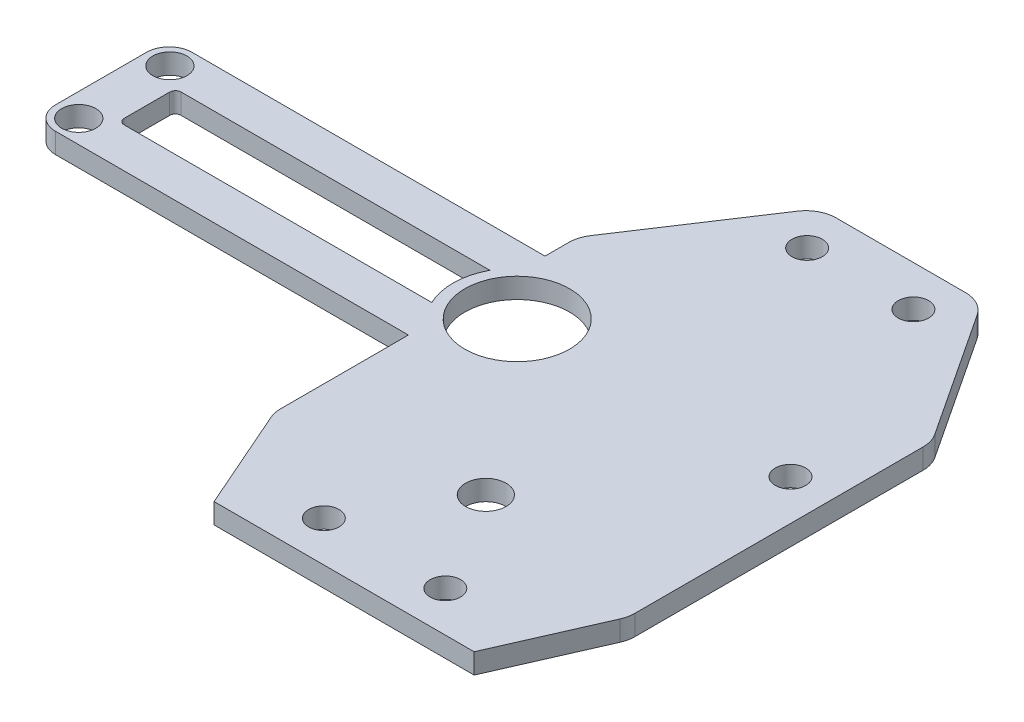
from build123d import *

# Parameters (mm, degrees)
CROQUIS1_R              = 1.5
CROQUIS1_R_2            = 2
SALIENTE_EXTRUIR1_DEPTH = 1
REDONDEO1_R             = 3
SCALE1_SCALE            = 0.888888889
SKETCH1_R               = 1.5
BOSS_EXTRUDE1_DEPTH     = 1.777777778
BOSS_EXTRUDE2_DEPTH     = 1.777777778
SKETCH3_R               = 4.6
CUT_EXTRUDE1_DEPTH      = 10


with BuildPart() as part:
    # Croquis1 → Saliente-Extruir1 (new, symmetric)
    with BuildSketch(Plane(origin=(0, 0, 0), x_dir=(1, 0, 0), z_dir=(0, 1, 0))):
        Polygon((-12.846620717, 7), (12.846620717, 7), (17.5, 17.599715907), (17.5, 47.599715907), (8, 62), (-8, 62), (-17.5, 47.599715907), (-17.5, 17.599715907), align=None)
        with Locations((-6, 11)):
            Circle(CROQUIS1_R, mode=Mode.SUBTRACT)
        with Locations((6, 11)):
            Circle(CROQUIS1_R, mode=Mode.SUBTRACT)
        with Locations((0, 21)):
            Circle(CROQUIS1_R_2, mode=Mode.SUBTRACT)
        with Locations((-13.5, 37.599715907)):
            Circle(CROQUIS1_R, mode=Mode.SUBTRACT)
        with Locations((-5.25, 57.994261746)):
            Circle(CROQUIS1_R, mode=Mode.SUBTRACT)
        with Locations((13.5, 37.599715907)):
            Circle(CROQUIS1_R, mode=Mode.SUBTRACT)
        with Locations((5.25, 57.994261746)):
            Circle(CROQUIS1_R, mode=Mode.SUBTRACT)
    extrude(amount=SALIENTE_EXTRUIR1_DEPTH, both=True)

    # Redondeo1
    redondeo1_edges = [part.edges().sort_by_distance(p)[0] for p in [
        (17.5, 0, -17.599715907),
        (-17.5, 0, -17.599715907),
        (-17.5, 0, -47.599715907),
        (-8, 0, -62),
        (8, 0, -62),
        (17.5, 0, -47.599715907),
    ]]
    fillet(redondeo1_edges, radius=REDONDEO1_R)


with BuildPart() as part_1:
    # Scale1: scaled about (0, 0, -33.418377338)
    add(part.part.scale(SCALE1_SCALE).moved(Location((0, 0, -3.713153038))))

    # Sketch1 → Boss-Extrude1 (add)
    with BuildSketch(Plane.XZ.offset(0.888888889)):
        with BuildLine():
            Line((-15.555555556, -31.135122733), (-46.555555556, -31.135122733))
            ThreePointArc((-46.555555556, -31.135122733), (-47.969769118, -31.72090917), (-48.555555556, -33.135122733))
            Line((-48.555555556, -33.135122733), (-48.555555556, -41.135122733))
            ThreePointArc((-48.555555556, -41.135122733), (-47.969769118, -42.549336295), (-46.555555556, -43.135122733))
            Line((-46.555555556, -43.135122733), (-15.555555556, -43.135122733))
            Line((-15.555555556, -43.135122733), (-15.555555556, -39.635122733))
            Line((-15.555555556, -39.635122733), (-44.013890567, -39.635122733))
            ThreePointArc((-44.013890567, -39.635122733), (-44.367443957, -39.488676123), (-44.513890567, -39.135122733))
            Line((-44.513890567, -39.135122733), (-44.513890567, -35.135122733))
            ThreePointArc((-44.513890567, -35.135122733), (-44.367443957, -34.781569342), (-44.013890567, -34.635122733))
            Line((-44.013890567, -34.635122733), (-15.555555556, -34.635122733))
            Line((-15.555555556, -34.635122733), (-15.555555556, -31.135122733))
        make_face()
        with Locations(Location((-46.5, -33.135122733, 0), (0, 0, 270))):
            Circle(SKETCH1_R, mode=Mode.SUBTRACT)
        with Locations(Location((-46.5, -41.135122733, 0), (0, 0, 270))):
            Circle(SKETCH1_R, mode=Mode.SUBTRACT)
    extrude(amount=-BOSS_EXTRUDE1_DEPTH)

    # Sketch2 → Boss-Extrude2 (add)
    with BuildSketch(Plane(origin=(0, 0.888888889, 0), x_dir=(1, 0, 0), z_dir=(0, 1, 0))):
        with BuildLine():
            Line((-16.898979486, 39.635122733), (-15.555555556, 39.635122733))
            Line((-15.555555556, 39.635122733), (-15.555555556, 34.635122733))
            Line((-15.555555556, 34.635122733), (-17.0003696, 34.635122733))
            ThreePointArc((-17.0003696, 34.635122733), (-17.54520316, 37.147198875), (-16.898979486, 39.635122733))
        make_face()
    extrude(amount=-BOSS_EXTRUDE2_DEPTH)

    # Sketch3 → Cut-Extrude1 (cut)
    with BuildSketch(Plane(origin=(0, 0.888888889, 0), x_dir=(1, 0, 0), z_dir=(0, 1, 0))):
        with Locations(Location((-12, 37.135122733, 0), (0, 0, 270))):
            Circle(SKETCH3_R)
    extrude(amount=-CUT_EXTRUDE1_DEPTH, mode=Mode.SUBTRACT)


solid = part_1.part
